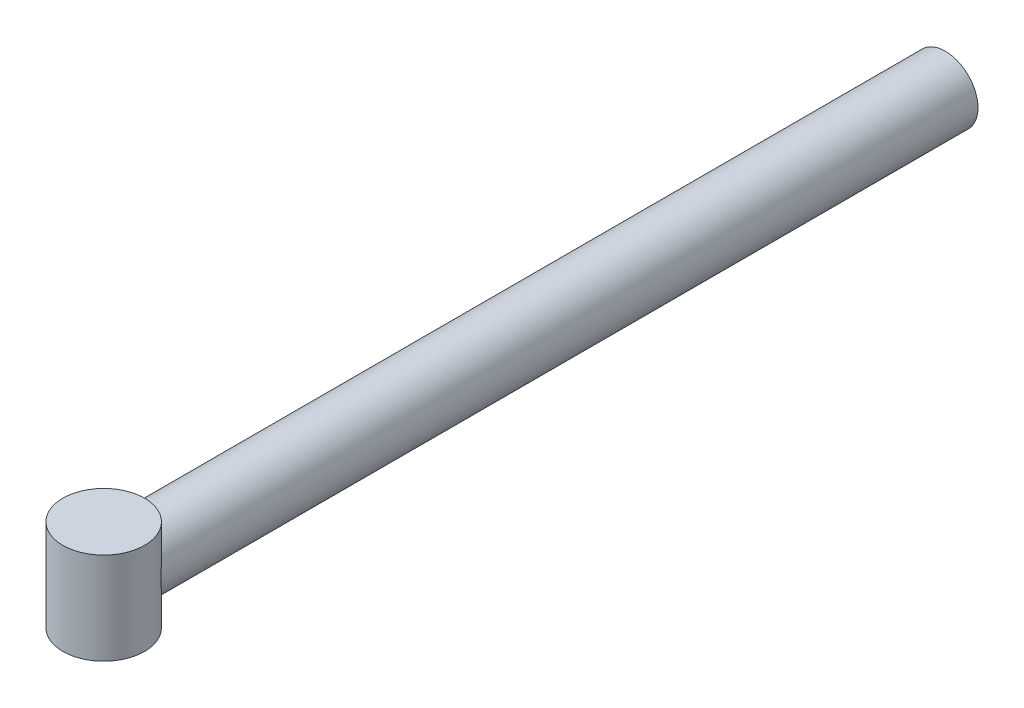
from build123d import *

# Parameters (mm, degrees)
SKETCH2_R           = 8
SKETCH2_R_2         = 7
BOSS_EXTRUDE1_DEPTH = 196
SKETCH3_R           = 8
BOSS_EXTRUDE2_DEPTH = 4
SKETCH6_R           = 10
BOSS_EXTRUDE3_DEPTH = 11.25


with BuildPart() as part:
    # Sketch2 → Boss-Extrude1 (new body)
    with BuildSketch(Plane.XY):
        Circle(SKETCH2_R)
        Circle(SKETCH2_R_2, mode=Mode.SUBTRACT)
    extrude(amount=BOSS_EXTRUDE1_DEPTH)

    # Sketch3 → Boss-Extrude2 (add)
    with BuildSketch(Plane.XY.offset(196)):
        Circle(SKETCH3_R)
    extrude(amount=BOSS_EXTRUDE2_DEPTH)

    # Sketch6 → Boss-Extrude3 (add, symmetric)
    with BuildSketch(Plane(origin=(0, 0, 0), x_dir=(1, 0, 0), z_dir=(0, 1, 0))):
        with Locations(Location((0, -206, 0), (0, 0, 270))):
            Circle(SKETCH6_R)
    extrude(amount=BOSS_EXTRUDE3_DEPTH, both=True)


solid = part.part
